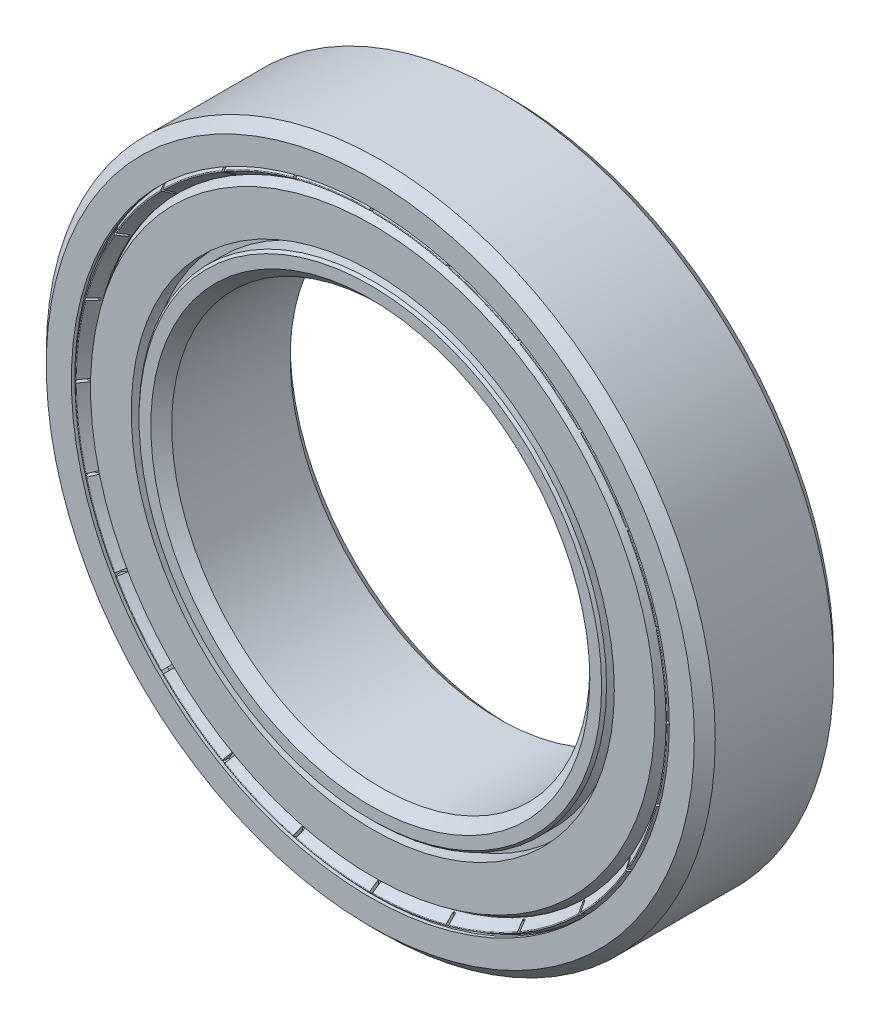
from build123d import *

# Parameters (mm, degrees)
CIRPATTERN1_COUNT  = 12
FILLET1_R          = 0.025
CUT_EXTRUDE1_START = 2.160909
CUT_EXTRUDE1_DEPTH = 15.992807798
CIRPATTERN2_COUNT  = 24


with BuildPart() as part:
    # Sketch3 → Revolve1 (revolve)
    with BuildSketch(Plane(origin=(0, 0, 0), x_dir=(0, 0, -1), z_dir=(1, 0, 0)), mode=Mode.PRIVATE) as revolve1_sk:
        with BuildLine():
            Line((2.125, 12), (-2.125, 12))
            Line((-2.125, 12), (-2.5, 11.625))
            Line((-2.5, 11.625), (-2.5, 10.726203327))
            Line((-2.5, 10.726203327), (-2.375, 10.726203327))
            Line((-2.375, 10.726203327), (-2.375, 11.025601663))
            Line((-2.375, 11.025601663), (-2.286611652, 11.113990011))
            Line((-2.286611652, 11.113990011), (-0.7875, 11.113990011))
            ThreePointArc((-0.7875, 11.113990011), (0, 11.325), (0.7875, 11.113990011))
            Line((0.7875, 11.113990011), (2.286611652, 11.113990011))
            Line((2.286611652, 11.113990011), (2.375, 11.025601663))
            Line((2.375, 11.025601663), (2.375, 10.726203327))
            Line((2.375, 10.726203327), (2.5, 10.726203327))
            Line((2.5, 10.726203327), (2.5, 11.625))
            Line((2.5, 11.625), (2.125, 12))
        make_face()
        with BuildLine():
            Line((2.125, 7.5), (-2.125, 7.5))
            Line((-2.125, 7.5), (-2.5, 7.875))
            Line((-2.5, 7.875), (-2.5, 8.297621641))
            Line((-2.5, 8.297621641), (-2.411611652, 8.386009989))
            Line((-2.411611652, 8.386009989), (-0.7875, 8.386009989))
            ThreePointArc((-0.7875, 8.386009989), (0, 8.175), (0.7875, 8.386009989))
            Line((0.7875, 8.386009989), (2.411611652, 8.386009989))
            Line((2.411611652, 8.386009989), (2.5, 8.297621641))
            Line((2.5, 8.297621641), (2.5, 7.875))
            Line((2.5, 7.875), (2.125, 7.5))
        make_face()
    revolve(revolve1_sk.sketch.rotate(Axis((0, 0, 2.5), (0, 0, -1)), 90), axis=Axis((0, 0, 2.5), (0, 0, -1)))


with BuildPart() as body_2:
    # Sketch4 → Revolve2 (revolve)
    with BuildSketch(Plane(origin=(0, 0, 0), x_dir=(0, 0, -1), z_dir=(1, 0, 0))):
        with BuildLine():
            Line((0, 11.325), (0, 8.175))
            ThreePointArc((0, 8.175), (-1.575, 9.75), (0, 11.325))
        make_face()
    revolve(axis=Axis((0, 12, 0), (0, -1, 0)))


with BuildPart() as cirpattern1_1:
    # CirPattern1: pattern copy
    add(body_2.part.rotate(Axis((0, 0, 0), (0, 0, 1)), 1 * 360 / CIRPATTERN1_COUNT))


with BuildPart() as cirpattern1_2:
    # CirPattern1: pattern copy
    add(body_2.part.rotate(Axis((0, 0, 0), (0, 0, 1)), 2 * 360 / CIRPATTERN1_COUNT))


with BuildPart() as cirpattern1_3:
    # CirPattern1: pattern copy
    add(body_2.part.rotate(Axis((0, 0, 0), (0, 0, 1)), 3 * 360 / CIRPATTERN1_COUNT))


with BuildPart() as cirpattern1_4:
    # CirPattern1: pattern copy
    add(body_2.part.rotate(Axis((0, 0, 0), (0, 0, 1)), 4 * 360 / CIRPATTERN1_COUNT))


with BuildPart() as cirpattern1_5:
    # CirPattern1: pattern copy
    add(body_2.part.rotate(Axis((0, 0, 0), (0, 0, 1)), 5 * 360 / CIRPATTERN1_COUNT))


with BuildPart() as cirpattern1_6:
    # CirPattern1: pattern copy
    add(body_2.part.rotate(Axis((0, 0, 0), (0, 0, 1)), 6 * 360 / CIRPATTERN1_COUNT))


with BuildPart() as cirpattern1_7:
    # CirPattern1: pattern copy
    add(body_2.part.rotate(Axis((0, 0, 0), (0, 0, 1)), 7 * 360 / CIRPATTERN1_COUNT))


with BuildPart() as cirpattern1_8:
    # CirPattern1: pattern copy
    add(body_2.part.rotate(Axis((0, 0, 0), (0, 0, 1)), 8 * 360 / CIRPATTERN1_COUNT))


with BuildPart() as cirpattern1_9:
    # CirPattern1: pattern copy
    add(body_2.part.rotate(Axis((0, 0, 0), (0, 0, 1)), 9 * 360 / CIRPATTERN1_COUNT))


with BuildPart() as cirpattern1_10:
    # CirPattern1: pattern copy
    add(body_2.part.rotate(Axis((0, 0, 0), (0, 0, 1)), 10 * 360 / CIRPATTERN1_COUNT))


with BuildPart() as cirpattern1_11:
    # CirPattern1: pattern copy
    add(body_2.part.rotate(Axis((0, 0, 0), (0, 0, 1)), 11 * 360 / CIRPATTERN1_COUNT))


with BuildPart() as body_14:
    # Sketch5 → Revolve3 (revolve)
    with BuildSketch(Plane(origin=(0, 0, 0), x_dir=(0, 0, -1), z_dir=(1, 0, 0)), mode=Mode.PRIVATE) as revolve3_sk:
        Polygon((-1.575, 8.386009989), (-1.853870551, 8.386009989), (-1.853870551, 8.66488054), (-2.411611652, 8.66488054), (-2.411611652, 10.125320801), (-1.853870551, 10.447332776), (-1.575, 10.447332776), align=None)
        Polygon((1.853870551, 10.447332776), (1.575, 10.447332776), (1.575, 8.386009989), (1.853870551, 8.386009989), (1.853870551, 8.66488054), (2.411611652, 8.66488054), (2.411611652, 10.125320801), align=None)
    revolve(revolve3_sk.sketch.rotate(Axis((0, 0, 2.5), (0, 0, -1)), 90), axis=Axis((0, 0, 2.5), (0, 0, -1)))


with BuildPart() as body_15:
    # Sketch6 → Revolve4 (revolve)
    with BuildSketch(Plane(origin=(0, 0, 0), x_dir=(0, 0, -1), z_dir=(1, 0, 0)), mode=Mode.PRIVATE) as revolve4_sk:
        Polygon((-2.040568652, 10.726203327), (-2.28125, 10.726203327), (-2.5, 10.599907955), (-2.115568652, 10.330726228), (-2.090568652, 10.330726228), (-2.040568652, 10.339542577), align=None)
    revolve(revolve4_sk.sketch.rotate(Axis((0, 0, 2.5), (0, 0, -1)), 90), axis=Axis((0, 0, 2.5), (0, 0, -1)))

    # Fillet1
    fillet1_edges = [body_15.edges().sort_by_distance(p)[0] for p in [
        (-10.599907955, 0, 2.5),
    ]]
    fillet(fillet1_edges, radius=FILLET1_R)

    # Sketch7 → Cut-Extrude1 (cut, through all)
    with BuildSketch(Plane.XY.offset(CUT_EXTRUDE1_START)):
        Polygon((-0.05, 10.726203327), (-0.05, 10.826203327), (0.05, 10.826203327), (0.05, 10.726203327), (0.05, 10.330726228), (0.05, 10.230726228), (-0.05, 10.230726228), (-0.05, 10.330726228), align=None)
    cut_extrude1 = extrude(amount=CUT_EXTRUDE1_DEPTH, mode=Mode.SUBTRACT)

    # CirPattern2: Cut-Extrude1 ×24 about axis
    cirpattern2_axis = Axis((0, 0, 0), (0, 0, 1))
    for i in range(1, CIRPATTERN2_COUNT):
        add(cut_extrude1.rotate(cirpattern2_axis, i * 360 / CIRPATTERN2_COUNT), mode=Mode.SUBTRACT)


with BuildPart() as body_16:
    # Mirror1: mirrored copy
    add(body_15.part.mirror(Plane.XY))


solid = Compound([part.part, body_2.part, cirpattern1_1.part, cirpattern1_2.part, cirpattern1_3.part, cirpattern1_4.part, cirpattern1_5.part, cirpattern1_6.part, cirpattern1_7.part, cirpattern1_8.part, cirpattern1_9.part, cirpattern1_10.part, cirpattern1_11.part, body_14.part, body_15.part, body_16.part])
